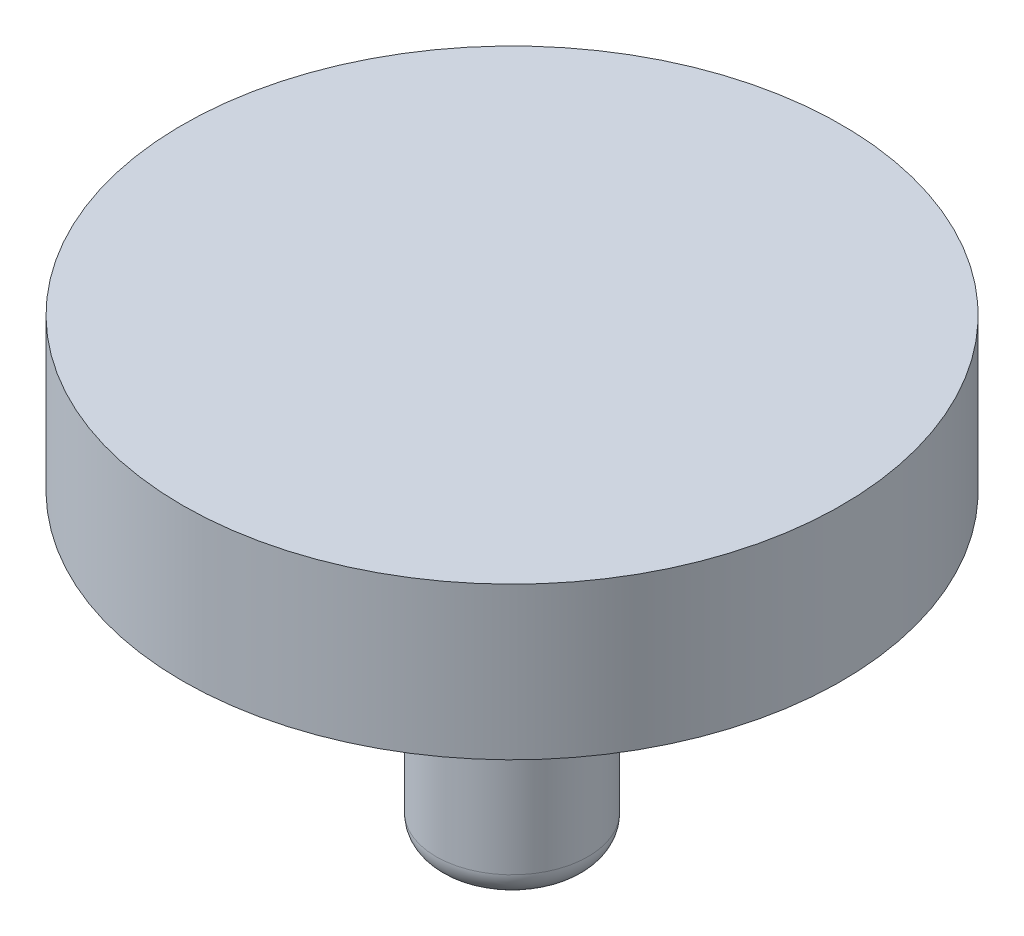
from build123d import *

# Parameters (mm, degrees)
SKETCH1_R           = 6.5
BOSS_EXTRUDE1_DEPTH = 3
SKETCH2_R           = 1.5
BOSS_EXTRUDE2_DEPTH = 6
FILLET1_R           = 0.5


with BuildPart() as part:
    # Sketch1 → Boss-Extrude1 (new body)
    with BuildSketch(Plane(origin=(0, 0, 0), x_dir=(1, 0, 0), z_dir=(0, 1, 0))):
        with Locations(Location((0, 0, 0), (0, 0, 270))):
            Circle(SKETCH1_R)
    extrude(amount=BOSS_EXTRUDE1_DEPTH)

    # Sketch2 → Boss-Extrude2 (add)
    with BuildSketch(Plane(origin=(0, 0, 0), x_dir=(1, 0, 0), z_dir=(0, 1, 0))):
        with Locations(Location((0, 0, 0), (0, 0, 270))):
            Circle(SKETCH2_R)
    extrude(amount=-BOSS_EXTRUDE2_DEPTH)

    # Fillet1
    fillet1_edges = [part.edges().sort_by_distance(p)[0] for p in [
        (0, -6, -1.5),
    ]]
    fillet(fillet1_edges, radius=FILLET1_R)


solid = part.part
